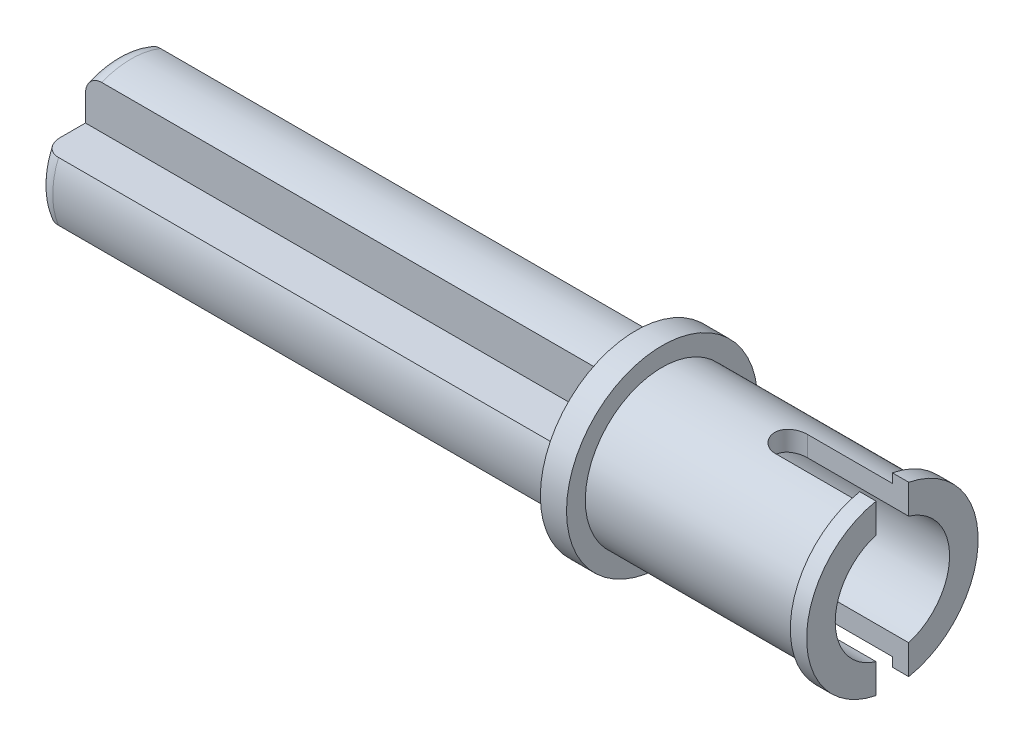
from build123d import *

# Parameters (mm, degrees)
SKETCH1_R             = 2.925
SKETCH1_R_2           = 1.7499999999999998
MIDDLE_RING_DEPTH     = 0.8
SKETCH2_R             = 2.35
SKETCH2_R_2           = 1.7499999999999998
OUTER_BODY_DEPTH      = 7.35
SKETCH3_R             = 2.625
SKETCH3_R_2           = 1.7499999999999998
OUTER_RIM_DEPTH       = 0.5
SIDE_SLOTS_DEPTH      = 9.873204043636097
SIDE_SLOTS_DEPTH_BACK = 9.873204043636097
AXLE_START            = 15.95
AXLE_DEPTH            = 15.95
FILLET1_R             = 0.5
SKETCH7_R             = 2.925
AXLE_BASE_DEPTH       = 0.8


with BuildPart() as part:
    # Sketch1 → Middle Ring (new body)
    with BuildSketch(Plane(origin=(0, 0, 0), x_dir=(0, 0, -1), z_dir=(1, 0, 0))):
        Circle(SKETCH1_R)
        Circle(SKETCH1_R_2, mode=Mode.SUBTRACT)
    extrude(amount=MIDDLE_RING_DEPTH)

    # Sketch2 → Outer Body (add)
    with BuildSketch(Plane(origin=(0, 0, 0), x_dir=(0, 0, -1), z_dir=(1, 0, 0))):
        Circle(SKETCH2_R)
        Circle(SKETCH2_R_2, mode=Mode.SUBTRACT)
    extrude(amount=OUTER_BODY_DEPTH)

    # Sketch3 → Outer Rim (add)
    with BuildSketch(Plane(origin=(7.35, 0, 0), x_dir=(0, 0, -1), z_dir=(1, 0, 0))):
        Circle(SKETCH3_R)
        Circle(SKETCH3_R_2, mode=Mode.SUBTRACT)
    extrude(amount=OUTER_RIM_DEPTH)

    # Sketch5 → Side Slots (cut, two sides: drawn at the far end of the back side and taken through both)
    with BuildSketch(Plane(origin=(0, 0, 0), x_dir=(1, 0, 0), z_dir=(0, 1, 0)).offset(-SIDE_SLOTS_DEPTH_BACK)):
        with BuildLine():
            Line((10.949999999999998, -0.4999999999999999), (4.750000000000001, -0.4999999999999999))
            ThreePointArc((4.750000000000001, -0.4999999999999999), (4.250000000000006, 6e-17), (4.750000000000001, 0.4999999999999945))
            Line((4.750000000000001, 0.4999999999999945), (10.949999999999998, 0.4999999999999945))
            ThreePointArc((10.949999999999998, 0.4999999999999945), (11.449999999999998, 0), (10.949999999999998, -0.4999999999999999))
        make_face()
        with BuildLine():
            Line((-10.949999999999998, -0.4999999999999999), (-4.750000000000001, -0.4999999999999999))
            ThreePointArc((-4.750000000000001, -0.4999999999999999), (-4.250000000000006, 0), (-4.750000000000001, 0.4999999999999945))
            Line((-4.750000000000001, 0.4999999999999945), (-10.949999999999998, 0.4999999999999945))
            ThreePointArc((-10.949999999999998, 0.4999999999999945), (-11.449999999999998, -6e-17), (-10.949999999999998, -0.4999999999999999))
        make_face()
    extrude(amount=SIDE_SLOTS_DEPTH + SIDE_SLOTS_DEPTH_BACK, mode=Mode.SUBTRACT)

    # Sketch6 → Axle (add)
    with BuildSketch(Plane.ZY.offset(AXLE_START)):
        Polygon((-0.8999999999999999, -0.8999999999999999), (0.9000000000000001, -0.8999999999999999), (0.9000000000000001, 0.8999999999999999), (-0.8999999999999999, 0.9), align=None)
        with BuildLine():
            Line((-1.5008331019803216, -0.8999999999999999), (-0.8999999999999999, -0.8999999999999999))
            Line((-0.8999999999999999, -0.8999999999999999), (-0.8999999999999999, 0.8999999999999999))
            Line((-0.8999999999999999, 0.9), (-1.5008331019803216, 0.9))
            ThreePointArc((-1.500833101980337, 0.9000000000000439), (-1.7499999999999998, 2.1e-16), (-1.5008331019803371, -0.9000000000000435))
        make_face()
        with BuildLine():
            Line((-0.8999999999999999, 0.9), (0.9000000000000001, 0.9))
            Line((0.9000000000000001, 0.8999999999999999), (0.9000000000000001, 1.5008331019803842))
            ThreePointArc((0.8999999999999783, 1.5008331019803764), (-1.233e-14, 1.7499999999999998), (-0.8999999999999996, 1.5008331019803633))
            Line((-0.8999999999999999, 1.5008331019803633), (-0.8999999999999999, 0.8999999999999999))
        make_face()
        with BuildLine():
            Line((1.5008331019803591, -0.8999999999999999), (2.2248595461286844, -0.8999999999999999))
            ThreePointArc((2.22485954612869, -0.9000000000000218), (2.3558080259975402, -0.458441429896527), (2.4, -5.9e-16))
            ThreePointArc((2.4, 0), (2.3558080259975402, 0.45844142989652675), (2.2248595461286897, 0.9000000000000221))
            Line((2.224859546128683, 0.9), (1.5008331019803582, 0.9))
            ThreePointArc((1.5008331019803602, 0.900000000000005), (1.6865583192504239, 0.46692722748538085), (1.7499999999999998, 0))
            ThreePointArc((1.7499999999999998, -4.3e-16), (1.6865583192504237, -0.46692722748538135), (1.500833101980361, -0.900000000000004))
        make_face()
        with BuildLine():
            ThreePointArc((-2.4, 2.9e-16), (-2.3558080259975434, -0.45844142989651143), (-2.2248595461287017, -0.8999999999999924))
            Line((-2.224859546128704, -0.8999999999999999), (-1.5008331019803216, -0.8999999999999999))
            ThreePointArc((-1.5008331019803371, -0.9000000000000435), (-1.7499999999999998, 2.1e-16), (-1.500833101980337, 0.9000000000000439))
            Line((-1.5008331019803216, 0.9), (-2.224859546128704, 0.9))
            ThreePointArc((-2.2248595461287013, 0.899999999999994), (-2.355808025997543, 0.458441429896512), (-2.4, 2.9e-16))
        make_face()
        with BuildLine():
            ThreePointArc((-0.9000000000000059, -2.2248595461286964), (-0.4584414298964598, -2.355808025997553), (1.168e-13, -2.4))
            ThreePointArc((1.168e-13, -2.4), (0.45844142989653847, -2.355808025997538), (0.8999999999999359, -2.224859546128725))
            Line((0.9000000000000001, -2.224859546128744), (0.9000000000000001, -1.5008331019803836))
            ThreePointArc((0.899999999999978, -1.5008331019803764), (-1.276e-14, -1.7499999999999998), (-0.8999999999999986, -1.500833101980364))
            Line((-0.8999999999999999, -1.5008331019803647), (-0.8999999999999999, -2.2248595461286946))
        make_face()
        with BuildLine():
            ThreePointArc((-0.8999999999999996, 1.5008331019803633), (-1.233e-14, 1.7499999999999998), (0.8999999999999783, 1.5008331019803764))
            Line((0.9000000000000001, 1.5008331019803842), (0.9000000000000001, 2.2248595461287435))
            ThreePointArc((0.899999999999937, 2.2248595461287244), (0.4584414298965443, 2.355808025997537), (1.2698e-13, 2.4))
            ThreePointArc((1.2698e-13, 2.4), (-0.4584414298964561, 2.355808025997554), (-0.9000000000000058, 2.2248595461286964))
            Line((-0.8999999999999999, 2.2248595461286946), (-0.8999999999999999, 1.5008331019803633))
        make_face()
        with BuildLine():
            Line((0.9000000000000001, 0.8999999999999999), (0.9000000000000001, -0.8999999999999999))
            Line((0.9000000000000001, -0.8999999999999999), (1.5008331019803591, -0.8999999999999999))
            ThreePointArc((1.500833101980361, -0.900000000000004), (1.6865583192504237, -0.46692722748538135), (1.7499999999999998, -4.3e-16))
            ThreePointArc((1.7499999999999998, 0), (1.6865583192504239, 0.46692722748538085), (1.5008331019803602, 0.900000000000005))
            Line((1.5008331019803582, 0.9), (0.9000000000000001, 0.9))
        make_face()
        with BuildLine():
            ThreePointArc((-0.8999999999999986, -1.500833101980364), (-1.276e-14, -1.7499999999999998), (0.899999999999978, -1.5008331019803764))
            Line((0.9000000000000001, -1.5008331019803836), (0.9000000000000001, -0.8999999999999999))
            Line((0.9000000000000001, -0.8999999999999999), (-0.8999999999999999, -0.8999999999999999))
            Line((-0.8999999999999999, -0.8999999999999999), (-0.8999999999999999, -1.5008331019803647))
        make_face()
    extrude(amount=-AXLE_DEPTH)

    # Fillet1
    fillet1_edges = [part.edges().sort_by_distance(p)[0] for p in [
        (-15.95, -2.4, -2.377e-14),
        (-15.95, 7.1e-16, -2.4000000000000004),
        (-15.95, 2.4000000000000004, -2.279e-14),
        (-15.95, -1.1e-16, 2.4000000000000004),
    ]]
    fillet(fillet1_edges, radius=FILLET1_R)

    # Sketch7 → Axle Base (add)
    with BuildSketch(Plane.ZY):
        with Locations(Location((0, 0, 0), (0, 0, 180))):
            Circle(SKETCH7_R)
    extrude(amount=-AXLE_BASE_DEPTH)


solid = part.part
